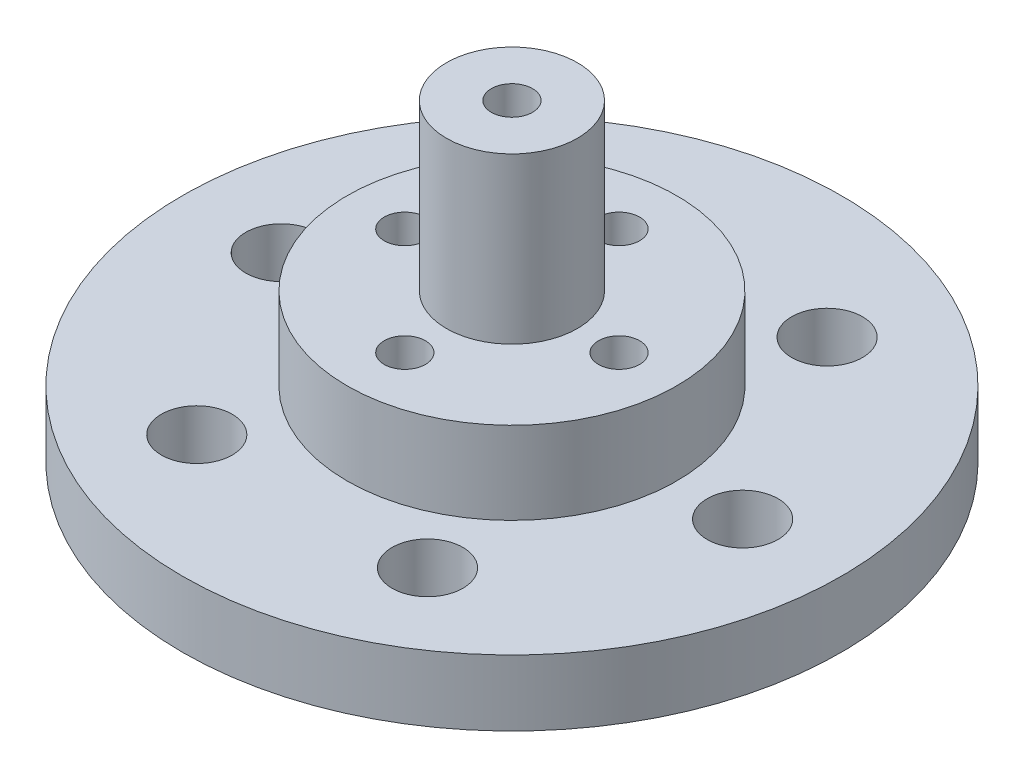
from build123d import *

# Parameters (mm, degrees)
SKETCH1_R             = 20
BOSS_EXTRUDE1_DEPTH   = 4
SKETCH2_R             = 10
BOSS_EXTRUDE2_DEPTH   = 5
SKETCH4_R             = 3.975
BOSS_EXTRUDE3_DEPTH   = 10
M4_CLEARANCE_HOLE2_D  = 4.3
M3_TAPPED_HOLE1_D     = 2.5
M3_TAPPED_HOLE1_DEPTH = 5
M3_TAPPED_HOLE1_TIP   = 0.751075774
M3_TAPPED_HOLE2_D     = 2.5
M3_TAPPED_HOLE2_DEPTH = 5
M3_TAPPED_HOLE2_TIP   = 0.751075774


with BuildPart() as part:
    # Sketch1 → Boss-Extrude1 (new body)
    with BuildSketch(Plane(origin=(0, 0, 0), x_dir=(1, 0, 0), z_dir=(0, 1, 0))):
        with Locations(Location((0, 0, 0), (0, 0, 270))):
            Circle(SKETCH1_R)
    extrude(amount=BOSS_EXTRUDE1_DEPTH)

    # Sketch2 → Boss-Extrude2 (add)
    with BuildSketch(Plane(origin=(0, 4, 0), x_dir=(1, 0, 0), z_dir=(0, 1, 0))):
        with Locations(Location((0, 0, 0), (0, 0, 270))):
            Circle(SKETCH2_R)
    extrude(amount=BOSS_EXTRUDE2_DEPTH)

    # Sketch4 → Boss-Extrude3 (add)
    with BuildSketch(Plane(origin=(0, 9, 0), x_dir=(1, 0, 0), z_dir=(0, 1, 0))):
        with Locations(Location((0, 0, 0), (0, 0, 270))):
            Circle(SKETCH4_R)
    extrude(amount=BOSS_EXTRUDE3_DEPTH)

    # M4 Clearance Hole2 (through all)
    with Locations(Plane(origin=(0, 4, 0), x_dir=(1, 0, 0), z_dir=(0, 1, 0))):
        with Locations((-14, 0), (-7, 12.124355653), (7, 12.124355653), (14, 0), (7, -12.124355653), (-7, -12.124355653)):
            Hole(M4_CLEARANCE_HOLE2_D / 2)

    # M3 Tapped Hole1
    with Locations(Plane(origin=(0, 9, 0), x_dir=(1, 0, 0), z_dir=(0, 1, 0))):
        with Locations((-6.5, 0), (0, 6.5), (6.5, 0), (0, -6.5)):
            Hole(M3_TAPPED_HOLE1_D / 2, depth=M3_TAPPED_HOLE1_DEPTH)
            with Locations((0, 0, -(M3_TAPPED_HOLE1_DEPTH + M3_TAPPED_HOLE1_TIP / 2))):  # 118° drill point
                Cone(0, M3_TAPPED_HOLE1_D / 2, M3_TAPPED_HOLE1_TIP, mode=Mode.SUBTRACT)

    # M3 Tapped Hole2
    with Locations(Plane(origin=(0, 19, 0), x_dir=(1, 0, 0), z_dir=(0, 1, 0))):
        with Locations((0, 0)):
            Hole(M3_TAPPED_HOLE2_D / 2, depth=M3_TAPPED_HOLE2_DEPTH)
            with Locations((0, 0, -(M3_TAPPED_HOLE2_DEPTH + M3_TAPPED_HOLE2_TIP / 2))):  # 118° drill point
                Cone(0, M3_TAPPED_HOLE2_D / 2, M3_TAPPED_HOLE2_TIP, mode=Mode.SUBTRACT)


solid = part.part
